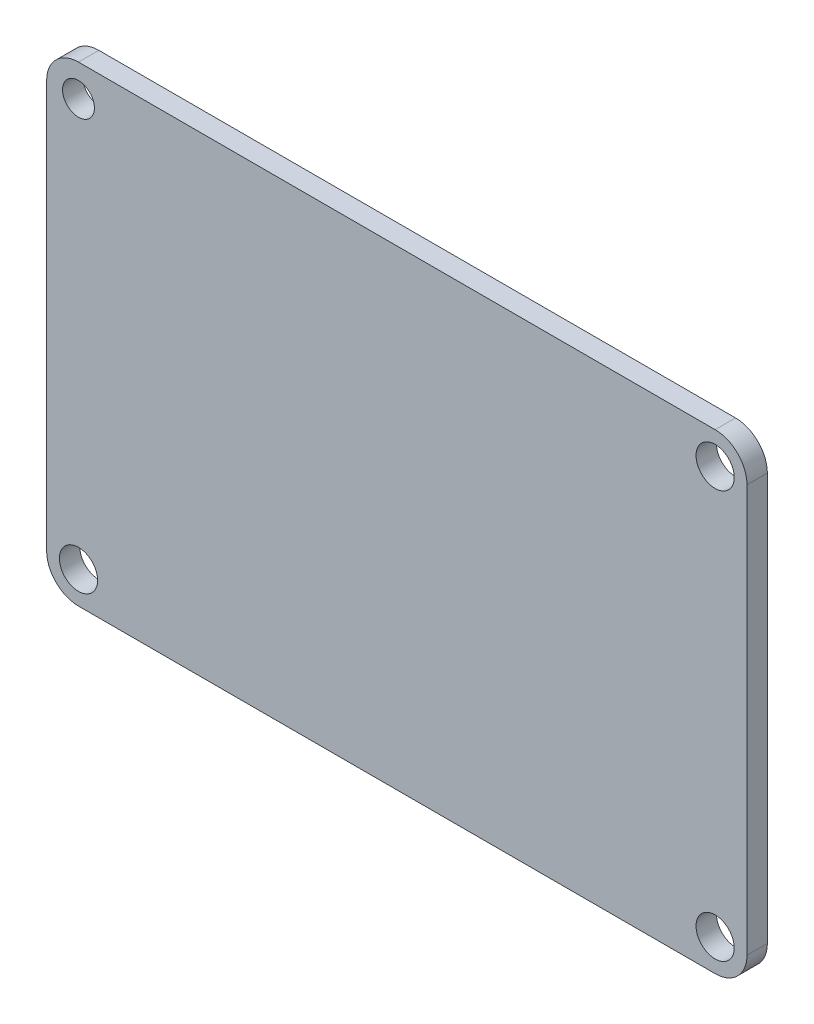
from build123d import *

# Parameters (mm, degrees)
SKETCH_1_W          = 55
SKETCH_1_H          = 37
EXTRUDE_1_DEPTH     = 1.6
CUT_EXTRUDE_1_DEPTH = 1.6
SKETCH_5_R          = 1.250363817
SKETCH_5_R_2        = 1.5
CUT_EXTRUDE_2_DEPTH = 1.6


with BuildPart() as part:
    # 草图1 → 凸台-拉伸1 (new body)
    with BuildSketch(Plane.XY):
        Rectangle(SKETCH_1_W, SKETCH_1_H)
    extrude(amount=EXTRUDE_1_DEPTH)

    # 草图3 → 切除-拉伸1 (cut)
    with BuildSketch(Plane.XY):
        with BuildLine():
            Line((-25, 18.5), (-27.5, 18.5))
            Line((-27.5, 18.5), (-27.5, 16))
            ThreePointArc((-27.5, 16), (-26.767766953, 17.767766953), (-25, 18.5))
        make_face()
        with BuildLine():
            Line((27.5, 16), (27.5, 18.5))
            Line((27.5, 18.5), (25, 18.5))
            ThreePointArc((25, 18.5), (26.767766953, 17.767766953), (27.5, 16))
        make_face()
        with BuildLine():
            Line((27.5, -18.5), (27.5, -16))
            ThreePointArc((27.5, -16), (26.767766953, -17.767766953), (25, -18.5))
            Line((25, -18.5), (27.5, -18.5))
        make_face()
        with BuildLine():
            Line((-27.5, -18.5), (-25, -18.5))
            ThreePointArc((-25, -18.5), (-26.767766953, -17.767766953), (-27.5, -16))
            Line((-27.5, -16), (-27.5, -18.5))
        make_face()
    extrude(amount=CUT_EXTRUDE_1_DEPTH, mode=Mode.SUBTRACT)

    # 草图5 → 切除-拉伸2 (cut)
    with BuildSketch(Plane.XY):
        with Locations(Location((-25, 16, 0), (0, 0, 180))):
            Circle(SKETCH_5_R)
        with Locations(Location((-25, -16, 0), (0, 0, 180))):
            Circle(SKETCH_5_R_2)
        with Locations(Location((25, 16, 0), (0, 0, 180))):
            Circle(SKETCH_5_R_2)
        with Locations(Location((25, -16, 0), (0, 0, 180))):
            Circle(SKETCH_5_R_2)
    extrude(amount=CUT_EXTRUDE_2_DEPTH, mode=Mode.SUBTRACT)


solid = part.part
